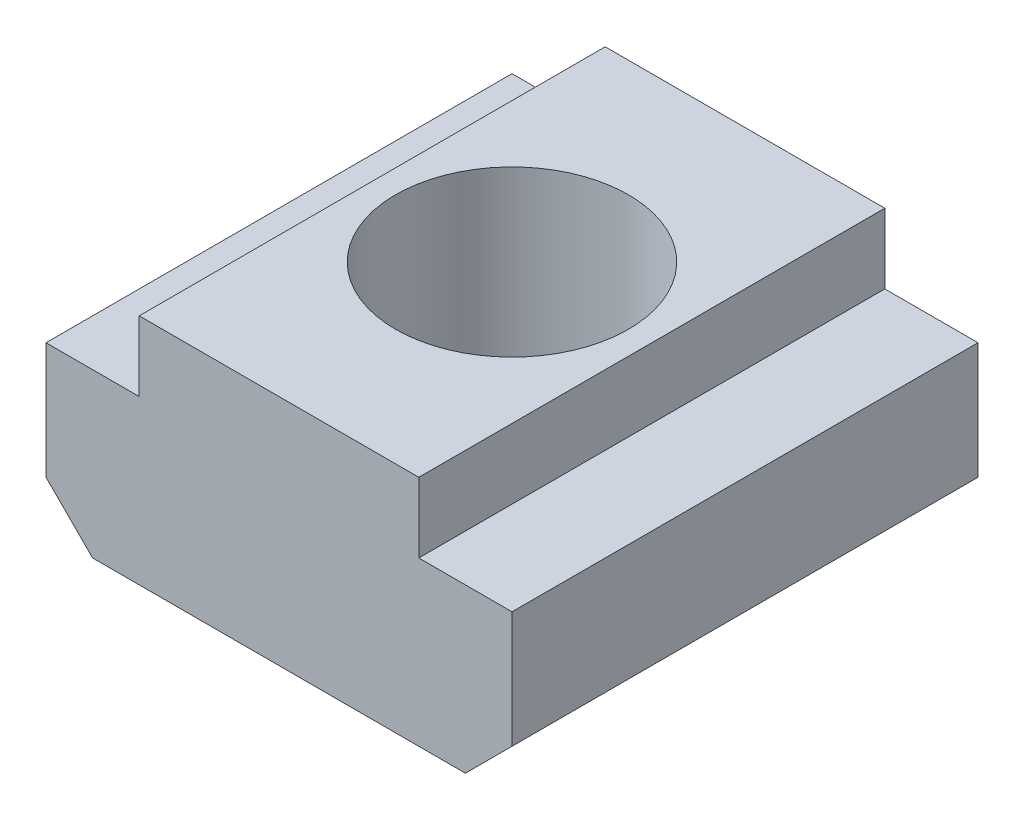
from build123d import *

# Parameters (mm, degrees)
BOSS_EXTRUDE1_DEPTH   = 10
M6X1_0_TAPPED_HOLE1_D = 5


with BuildPart() as part:
    # Sketch1 → Boss-Extrude1 (new body)
    with BuildSketch(Plane.XY):
        Polygon((-4, 0), (4, 0), (5, 1), (5, 3.5), (3, 3.5), (3, 5), (-3, 5), (-3, 3.5), (-5, 3.5), (-5, 1), align=None)
    extrude(amount=BOSS_EXTRUDE1_DEPTH)

    # M6x1.0 Tapped Hole1 (through all)
    with Locations(Plane(origin=(0, 5, 0), x_dir=(1, 0, 0), z_dir=(0, 1, 0))):
        with Locations((0, -5)):
            Hole(M6X1_0_TAPPED_HOLE1_D / 2)


solid = part.part
